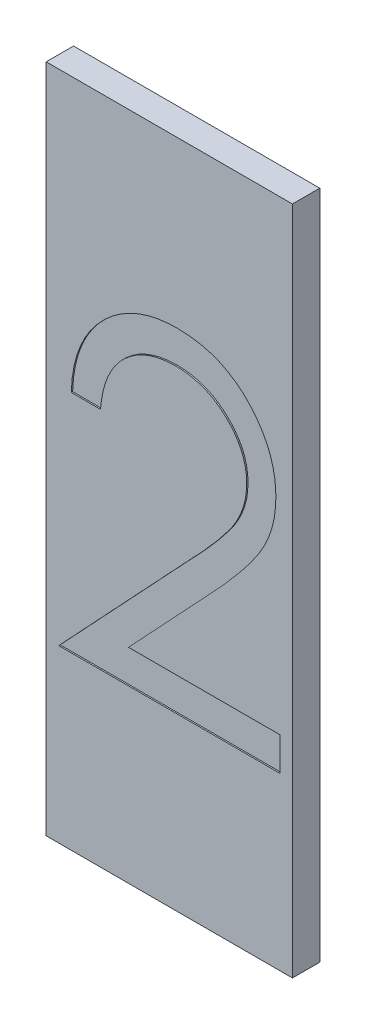
from build123d import *

# Parameters (mm, degrees)
SKETCH_1_W          = 18
SKETCH_1_H          = 49
EXTRUDE_1_DEPTH     = 2
CUT_EXTRUDE_1_DEPTH = 0.1


with BuildPart() as part:
    # ｽｹｯﾁ1 → ﾎﾞｽ - 押し出し1 (new body)
    with BuildSketch(Plane.XY):
        with Locations((9, 24.5)):
            Rectangle(SKETCH_1_W, SKETCH_1_H)
    extrude(amount=EXTRUDE_1_DEPTH)

    # ｽｹｯﾁ2 → ｶｯﾄ - 押し出し1 (cut)
    with BuildSketch(Plane.XY.offset(2)):
        with BuildLine():
            Line((3.96875, 28.985576923), (1.831730769, 28.985576923))
            add(Edge.make_bspline(
                [(1.831730769, 28.985576923), (1.845658721, 29.269087784), (1.873012847, 29.825895571), (2.001112458, 30.637724291), (2.184406641, 31.413704261), (2.443564569, 32.147604926), (2.765416209, 32.845915382), (3.151383002, 33.505861918), (3.608541164, 34.12492697), (4.127019122, 34.6973716), (4.69014147, 35.222522751), (5.297740808, 35.676016457), (5.936222155, 36.059177756), (6.603648422, 36.379498348), (7.307549757, 36.619935514), (8.041538486, 36.798336312), (8.808839396, 36.905671807), (9.331625975, 36.917209206), (9.59750601, 36.923076923)],
                knots=[0, 0, 0, 0, 1.10065271, 2.161652631, 3.183658789, 4.190468796, 5.17591951, 6.163126047, 7.15150782, 8.156236427, 9.156009102, 10.134482811, 11.092018607, 12.041330605, 13.001268258, 13.972401359, 14.968799086, 16, 16, 16, 16], degree=3))
            add(Edge.make_bspline(
                [(9.59750601, 36.923076923), (9.858613978, 36.91696421), (10.371681809, 36.904952949), (11.120496585, 36.801803803), (11.833356392, 36.640248974), (12.508867804, 36.41358516), (13.141641208, 36.108891109), (13.736430136, 35.742875712), (14.300315652, 35.319558645), (14.807908233, 34.821171093), (15.274007844, 34.289115584), (15.676114258, 33.721099669), (16.020464531, 33.134432564), (16.307491425, 32.524640692), (16.518784084, 31.885982446), (16.679200107, 31.227755941), (16.769874118, 30.543147852), (16.783790303, 30.079780036), (16.790865385, 29.844200721)],
                knots=[0, 0, 0, 0, 1.111607364, 2.184268762, 3.212621178, 4.221274766, 5.211760367, 6.196651075, 7.1921475, 8.207485113, 9.220403448, 10.201281604, 11.166441695, 12.114753415, 13.065576456, 14.026450734, 14.996634279, 16, 16, 16, 16], degree=3))
            add(Edge.make_bspline(
                [(16.790865385, 29.844200721), (16.77934515, 29.512541347), (16.756506844, 28.85504275), (16.561146532, 27.888834487), (16.25603009, 26.952707833), (15.888655216, 26.199298688), (15.518048052, 25.592192239), (15.184077688, 25.092342658), (14.793111742, 24.554142953), (14.339459818, 23.979395354), (13.83250617, 23.363597946), (13.267658951, 22.707122731), (12.640890261, 22.016752297), (12.200981533, 21.545226688), (11.973031851, 21.30089393)],
                knots=[0, 0, 0, 0, 1.184426356, 2.348067706, 3.509069118, 4.696110526, 5.333549288, 6.050745305, 6.844228056, 7.710549037, 8.667450064, 9.695053472, 10.805634456, 12, 12, 12, 12], degree=3))
            Line((11.973031851, 21.30089393), (6.015136719, 14.942307692))
            Line((6.015136719, 14.942307692), (17.096153846, 14.942307692))
            Line((17.096153846, 14.942307692), (17.096153846, 12.5))
            Line((17.096153846, 12.5), (0.915865385, 12.5))
            Line((0.915865385, 12.5), (10.150841346, 22.355093149))
            add(Edge.make_bspline(
                [(10.150841346, 22.355093149), (10.375685005, 22.589804842), (10.807563657, 23.040637969), (11.418405831, 23.698835608), (11.967038948, 24.309453019), (12.457014424, 24.871336501), (12.877703095, 25.392704846), (13.251030244, 25.856672383), (13.550153283, 26.283626768), (13.874788385, 26.77852273), (14.189208509, 27.382763674), (14.45939436, 28.121180381), (14.624141811, 28.881324725), (14.643905067, 29.395008227), (14.653846154, 29.653395433)],
                knots=[0, 0, 0, 0, 1.329631726, 2.553950428, 3.673215718, 4.687767853, 5.603093632, 6.413772471, 7.123043292, 7.734684054, 8.834405432, 9.900288307, 10.943827018, 12, 12, 12, 12], degree=3))
            add(Edge.make_bspline(
                [(14.653846154, 29.653395433), (14.649520836, 29.815874233), (14.640996464, 30.136088747), (14.565764629, 30.605574357), (14.452073508, 31.058452823), (14.289160234, 31.496117178), (14.07412152, 31.91416706), (13.812365132, 32.313111345), (13.510354165, 32.698798769), (13.160982136, 33.060431029), (12.777182332, 33.391637088), (12.371728598, 33.685034883), (11.94276271, 33.930229548), (11.492093307, 34.131230841), (11.02097681, 34.288906203), (10.528502026, 34.398161895), (10.016029701, 34.466758795), (9.666098239, 34.476040036), (9.487792969, 34.480769231)],
                knots=[0, 0, 0, 0, 0.991446411, 1.95395049, 2.89581595, 3.838931463, 4.798493298, 5.75982156, 6.748411868, 7.785213223, 8.824556874, 9.840280684, 10.836137867, 11.835679398, 12.848801643, 13.863922112, 14.911575587, 16, 16, 16, 16], degree=3))
            add(Edge.make_bspline(
                [(9.487792969, 34.480769231), (9.301573553, 34.475904458), (8.935869368, 34.466350847), (8.39893809, 34.399521651), (7.886725925, 34.284229415), (7.397944407, 34.126545255), (6.931766511, 33.926121914), (6.490459354, 33.676487008), (6.075013625, 33.378602885), (5.68464835, 33.040869815), (5.324984493, 32.664852742), (5.008979855, 32.245684958), (4.732863616, 31.791019864), (4.491954367, 31.302084261), (4.296312976, 30.774441579), (4.146817077, 30.209964873), (4.028524423, 29.611105117), (3.989005739, 29.19754945), (3.96875, 28.985576923)],
                knots=[0, 0, 0, 0, 1.031018746, 2.02475058, 2.990194455, 3.934040569, 4.864654155, 5.795059489, 6.735614925, 7.690564532, 8.649604399, 9.611025574, 10.590972636, 11.591080095, 12.624614302, 13.701020113, 14.821632451, 16, 16, 16, 16], degree=3))
        make_face()
    extrude(amount=-CUT_EXTRUDE_1_DEPTH, mode=Mode.SUBTRACT)


solid = part.part
